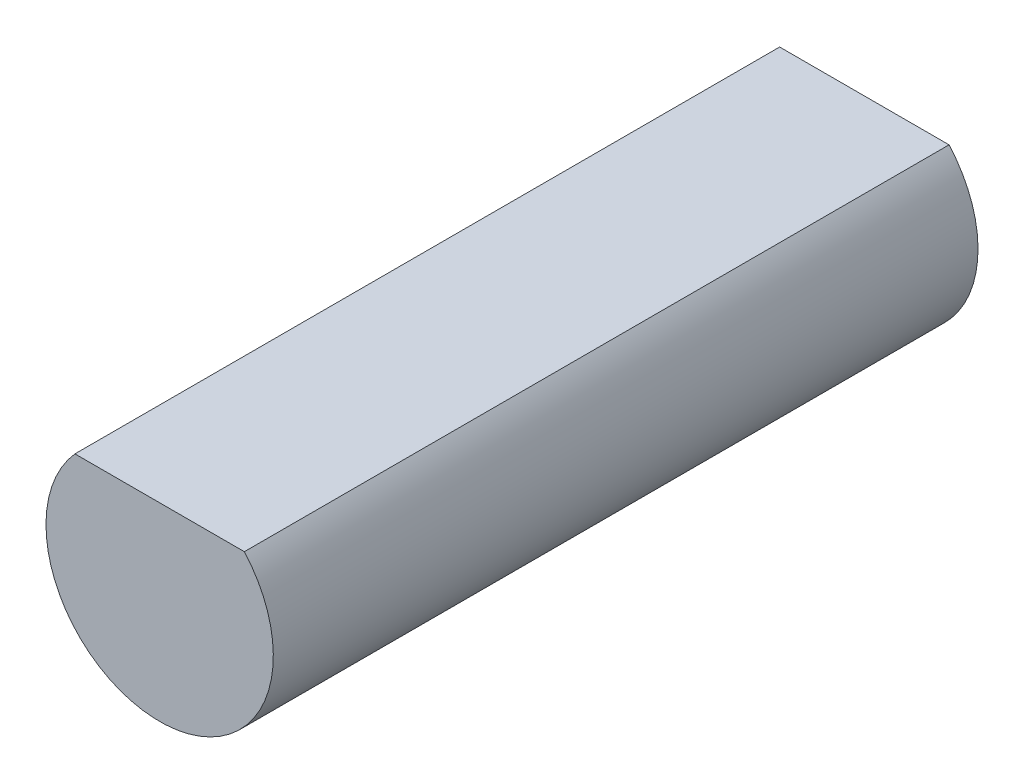
from build123d import *

# Parameters (mm, degrees)
BOSS_EXTRUDE1_DEPTH = 9.3


with BuildPart() as part:
    # Sketch1 → Boss-Extrude1 (new body)
    with BuildSketch(Plane.XY):
        with BuildLine():
            Line((-1.118033989, 1), (1.118033989, 1))
            ThreePointArc((1.118033989, 1), (0, -1.5), (-1.118033989, 1))
        make_face()
    extrude(amount=BOSS_EXTRUDE1_DEPTH)


solid = part.part
